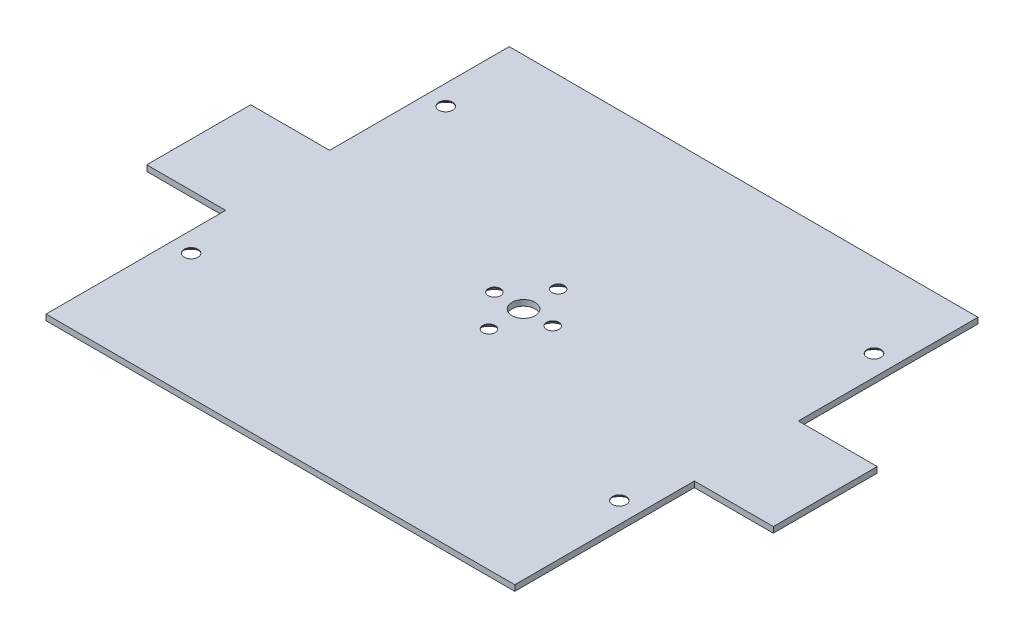
from build123d import *

# Parameters (mm, degrees)
BOSS_EXTRUDE1_DEPTH                            = 1.5875
CSK_FOR_6_FLAT_HEAD_MACHINE_SCREW_2_COUNT      = 2
CSK_FOR_6_FLAT_HEAD_MACHINE_SCREW_2_PITCH      = 69.85
CSK_FOR_6_FLAT_HEAD_MACHINE_SCREW_3_COUNT      = 2
CSK_FOR_6_FLAT_HEAD_MACHINE_SCREW_3_PITCH      = 136.672594638
CSK_FOR_6_FLAT_HEAD_MACHINE_SCREW_4_COUNT      = 2
CSK_FOR_6_FLAT_HEAD_MACHINE_SCREW_4_PITCH      = 117.475
SKETCH4_R                                      = 3.175
CUT_EXTRUDE1_DEPTH                             = 107.878457248
CSK_FOR_M3_FLAT_HEAD_MACHINE_SCREW2_AT_2_COUNT = 2
CSK_FOR_M3_FLAT_HEAD_MACHINE_SCREW2_AT_2_PITCH = 16
CSK_FOR_M3_FLAT_HEAD_MACHINE_SCREW2_AT_3_COUNT = 2
CSK_FOR_M3_FLAT_HEAD_MACHINE_SCREW2_AT_3_PITCH = 12.419742348
CSK_FOR_M3_FLAT_HEAD_MACHINE_SCREW2_AT_4_COUNT = 2
CSK_FOR_M3_FLAT_HEAD_MACHINE_SCREW2_AT_4_PITCH = 12.419742348


with BuildPart() as part:
    # Sketch1 → Boss-Extrude1 (new body)
    with BuildSketch(Plane(origin=(0, 0, 0), x_dir=(1, 0, 0), z_dir=(0, 1, 0))):
        Polygon((-64.29375, 63.53175), (64.29375, 63.53175), (64.29375, 14.25575), (85.931375, 14.25575), (85.931375, -14.25575), (64.29375, -14.25575), (64.29375, -63.53175), (-64.29375, -63.53175), (-64.29375, -14.25575), (-85.931375, -14.25575), (-85.931375, 14.25575), (-64.29375, 14.25575), align=None)
    extrude(amount=BOSS_EXTRUDE1_DEPTH)

    # Sketch2 → CSK for #6 Flat Head Machine Screw (100)1 (revolve, cut)
    with BuildSketch(Plane(origin=(-58.848625, 0, 29.17825), x_dir=(0, 0, -1), z_dir=(1, 0, 0))):
        Polygon((0, 0), (0, 1.5875), (1.89865, 1.5875), (1.89865, 1.380025208), (3.5433, 0), align=None)
    csk_for_6_flat_head_machine_screw_100 = revolve(axis=Axis((-58.848625, -6.35, 29.17825), (0, 1, 0)), mode=Mode.SUBTRACT)

    # CSK for _6 Flat Head Machine Screw _ 2: CSK for #6 Flat Head Machine Screw (100)1 ×2
    with Locations(*[(0, 0, -i * CSK_FOR_6_FLAT_HEAD_MACHINE_SCREW_2_PITCH) for i in range(1, CSK_FOR_6_FLAT_HEAD_MACHINE_SCREW_2_COUNT)]):
        add(csk_for_6_flat_head_machine_screw_100, mode=Mode.SUBTRACT)

    # CSK for _6 Flat Head Machine Screw _ 3: CSK for #6 Flat Head Machine Screw (100)1 ×2
    with Locations(*[Vector(0.8595358880206613, 0, -0.5110753928771502) * (i * CSK_FOR_6_FLAT_HEAD_MACHINE_SCREW_3_PITCH) for i in range(1, CSK_FOR_6_FLAT_HEAD_MACHINE_SCREW_3_COUNT)]):
        add(csk_for_6_flat_head_machine_screw_100, mode=Mode.SUBTRACT)

    # CSK for _6 Flat Head Machine Screw _ 4: CSK for #6 Flat Head Machine Screw (100)1 ×2
    with Locations(*[(i * CSK_FOR_6_FLAT_HEAD_MACHINE_SCREW_4_PITCH, 0, 0) for i in range(1, CSK_FOR_6_FLAT_HEAD_MACHINE_SCREW_4_COUNT)]):
        add(csk_for_6_flat_head_machine_screw_100, mode=Mode.SUBTRACT)

    # Sketch4 → Cut-Extrude1 (cut, through all)
    with BuildSketch(Plane.XZ):
        with Locations(Location((0, -3.175, 0), (0, 0, 270))):
            Circle(SKETCH4_R)
    extrude(amount=-CUT_EXTRUDE1_DEPTH, mode=Mode.SUBTRACT)

    # Sketch5 → CSK for M3 Flat Head Machine Screw2 (revolve, cut)
    with BuildSketch(Plane(origin=(8, 0, -3.175), x_dir=(0, 0, -1), z_dir=(1, 0, 0))):
        Polygon((0, 0), (0, 1.5875), (1.7, 1.5875), (1.7, 1.45), (3.15, 0), align=None)
    csk_for_m3_flat_head_machine_screw2 = revolve(axis=Axis((8, -6.35, -3.175), (0, 1, 0)), mode=Mode.SUBTRACT)

    # CSK for M3 Flat Head Machine Screw2 at 2: CSK for M3 Flat Head Machine Screw2 ×2
    with Locations(*[(-i * CSK_FOR_M3_FLAT_HEAD_MACHINE_SCREW2_AT_2_PITCH, 0, 0) for i in range(1, CSK_FOR_M3_FLAT_HEAD_MACHINE_SCREW2_AT_2_COUNT)]):
        add(csk_for_m3_flat_head_machine_screw2, mode=Mode.SUBTRACT)

    # CSK for M3 Flat Head Machine Screw2 at 3: CSK for M3 Flat Head Machine Screw2 ×2
    with Locations(*[Vector(-0.6441357457827798, 0, -0.7649111981170509) * (i * CSK_FOR_M3_FLAT_HEAD_MACHINE_SCREW2_AT_3_PITCH) for i in range(1, CSK_FOR_M3_FLAT_HEAD_MACHINE_SCREW2_AT_3_COUNT)]):
        add(csk_for_m3_flat_head_machine_screw2, mode=Mode.SUBTRACT)

    # CSK for M3 Flat Head Machine Screw2 at 4: CSK for M3 Flat Head Machine Screw2 ×2
    with Locations(*[Vector(-0.6441357457827798, 0, 0.7649111981170509) * (i * CSK_FOR_M3_FLAT_HEAD_MACHINE_SCREW2_AT_4_PITCH) for i in range(1, CSK_FOR_M3_FLAT_HEAD_MACHINE_SCREW2_AT_4_COUNT)]):
        add(csk_for_m3_flat_head_machine_screw2, mode=Mode.SUBTRACT)


solid = part.part
